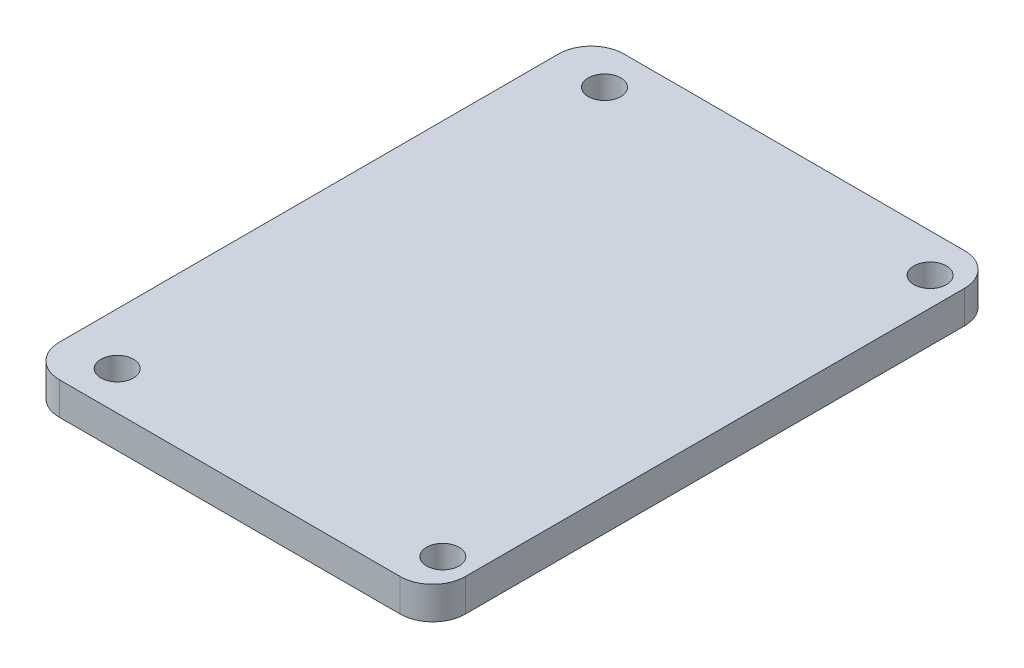
from build123d import *

# Parameters (mm, degrees)
SKETCH2_W           = 65
SKETCH2_H           = 52
SKETCH2_R           = 1.5
BOSS_EXTRUDE1_DEPTH = 3
FILLET1_R           = 3
CUT_EXTRUDE1_START  = -10
SKETCH3_R           = 1.5
CUT_EXTRUDE1_DEPTH  = 10
SKETCH4_R           = 1.5
CUT_EXTRUDE2_DEPTH  = 10
FILLET2_R           = 3


with BuildPart() as part:
    # Sketch2 → Boss-Extrude1 (new body)
    with BuildSketch(Plane(origin=(0, 0, 0), x_dir=(1, 0, 0), z_dir=(0, 1, 0))):
        with Locations((-5, 0)):
            Rectangle(SKETCH2_W, SKETCH2_H)
        with Locations(Location((-24.875, 22.45, 0), (0, 0, 270))):
            Circle(SKETCH2_R, mode=Mode.SUBTRACT)
        with Locations(Location((24.875, 22.45, 0), (0, 0, 270))):
            Circle(SKETCH2_R, mode=Mode.SUBTRACT)
        with Locations(Location((24.875, -22.45, 0), (0, 0, 270))):
            Circle(SKETCH2_R, mode=Mode.SUBTRACT)
        with Locations(Location((-24.875, -22.45, 0), (0, 0, 270))):
            Circle(SKETCH2_R, mode=Mode.SUBTRACT)
    extrude(amount=BOSS_EXTRUDE1_DEPTH)

    # Fillet1
    fillet1_edges = [part.edges().sort_by_distance(p)[0] for p in [
        (-37.5, 1.5, 26),
        (-37.5, 1.5, -26),
        (27.5, 1.5, -26),
        (27.5, 1.5, 26),
    ]]
    fillet(fillet1_edges, radius=FILLET1_R)

    # Sketch3 → Cut-Extrude1 (cut)
    with BuildSketch(Plane(origin=(0, 3, 0), x_dir=(1, 0, 0), z_dir=(0, 1, 0)).offset(CUT_EXTRUDE1_START)):
        with Locations(Location((24.875, 22.45, 0), (0, 0, 270))):
            Circle(SKETCH3_R)
        with Locations(Location((-5.125, 22.45, 0), (0, 0, 270))):
            Circle(SKETCH3_R)
        with Locations(Location((-5.125, -22.45, 0), (0, 0, 270))):
            Circle(SKETCH3_R)
        with Locations(Location((24.875, -22.45, 0), (0, 0, 270))):
            Circle(SKETCH3_R)
    extrude(amount=CUT_EXTRUDE1_DEPTH, mode=Mode.SUBTRACT)

    # Sketch4 → Cut-Extrude2 (cut)
    with BuildSketch(Plane(origin=(0, 3, 0), x_dir=(1, 0, 0), z_dir=(0, 1, 0))):
        with BuildLine():
            Line((-9.9, -26), (-9.9, 0))
            Line((-9.9, 0), (-9.9, 26))
            Line((-9.9, 26), (-34.5, 26))
            ThreePointArc((-34.5, 26), (-36.621320344, 25.121320344), (-37.5, 23))
            Line((-37.5, 23), (-37.5, -23))
            ThreePointArc((-37.5, -23), (-36.621320344, -25.121320344), (-34.5, -26))
            Line((-34.5, -26), (-9.9, -26))
        make_face()
        with Locations((-24.875, -22.45)):
            Circle(SKETCH4_R, mode=Mode.SUBTRACT)
        with Locations((-24.875, 22.45)):
            Circle(SKETCH4_R, mode=Mode.SUBTRACT)
    extrude(amount=-CUT_EXTRUDE2_DEPTH, mode=Mode.SUBTRACT)

    # Fillet2
    fillet2_edges = [part.edges().sort_by_distance(p)[0] for p in [
        (-9.9, 1.5, -26),
        (-9.9, 1.5, 26),
    ]]
    fillet(fillet2_edges, radius=FILLET2_R)


solid = part.part
